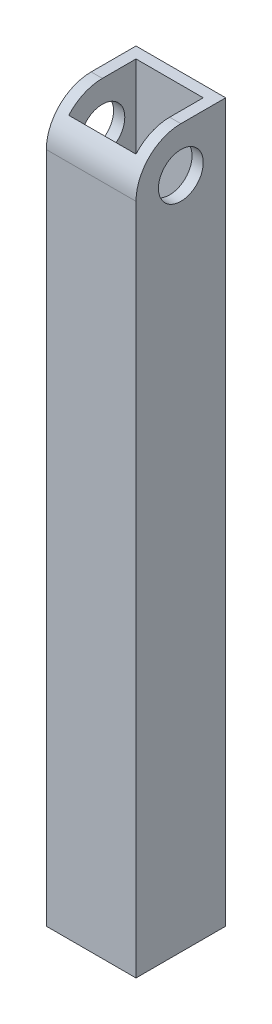
from build123d import *

# Parameters (mm, degrees)
SKETCH1_W           = 25.4
SKETCH1_H           = 25.4
SKETCH1_W_2         = 19.05
SKETCH1_H_2         = 19.05
EXTRUDE_THIN1_DEPTH = 203.2
SKETCH2_R           = 6.35
CUT_EXTRUDE1_DEPTH  = 206.174779152
CUT_EXTRUDE3_DEPTH  = 206.174779152


with BuildPart() as part:
    # Sketch1 → Extrude-Thin1 (new body)
    with BuildSketch(Plane(origin=(0, 0, 0), x_dir=(1, 0, 0), z_dir=(0, 1, 0))):
        Rectangle(SKETCH1_W, SKETCH1_H)
        Rectangle(SKETCH1_W_2, SKETCH1_H_2, mode=Mode.SUBTRACT)
    extrude(amount=EXTRUDE_THIN1_DEPTH)

    # Sketch2 → Cut-Extrude1 (cut, through all)
    with BuildSketch(Plane(origin=(12.7, 0, 0), x_dir=(0, 0, -1), z_dir=(1, 0, 0))):
        with Locations((0, 190.5)):
            Circle(SKETCH2_R)
    extrude(amount=-CUT_EXTRUDE1_DEPTH, mode=Mode.SUBTRACT)

    # Sketch4 → Cut-Extrude3 (cut, through all)
    with BuildSketch(Plane(origin=(12.7, 0, 0), x_dir=(0, 0, -1), z_dir=(1, 0, 0))):
        with BuildLine():
            Line((-12.7, 190.5), (-12.7, 203.2))
            Line((-12.7, 203.2), (0, 203.2))
            ThreePointArc((0, 203.2), (-8.980256121, 199.480256121), (-12.7, 190.5))
        make_face()
    extrude(amount=-CUT_EXTRUDE3_DEPTH, mode=Mode.SUBTRACT)


solid = part.part
